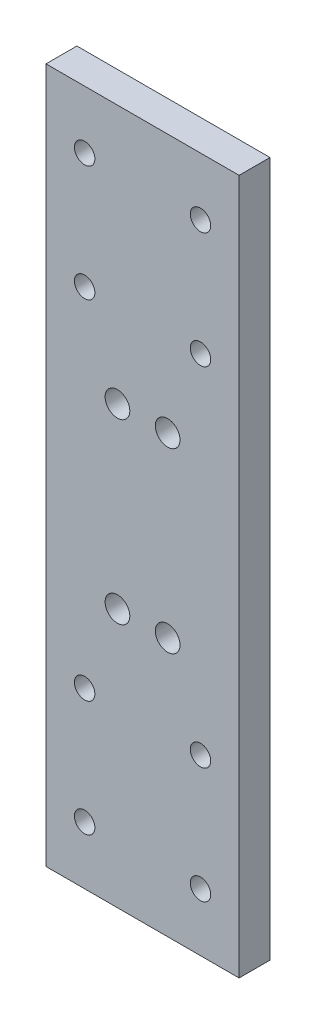
from build123d import *

# Parameters (mm, degrees)
SKETCH1_W            = 50
SKETCH1_H            = 180
BOSS_EXTRUDE1_DEPTH  = 8
M5_CLEARANCE_HOLE1_D = 5.3
M6_CLEARANCE_HOLE1_D = 6.4


with BuildPart() as part:
    # Sketch1 → Boss-Extrude1 (new body)
    with BuildSketch(Plane.XY):
        Rectangle(SKETCH1_W, SKETCH1_H)
    extrude(amount=BOSS_EXTRUDE1_DEPTH)

    # M5 Clearance Hole1 (through all)
    with Locations(Plane.XY.offset(8)):
        with Locations((-15, 45), (-15, -45), (15, -45), (15, 45), (-15, 75), (-15, -75), (15, -75), (15, 75)):
            Hole(M5_CLEARANCE_HOLE1_D / 2)

    # M6 Clearance Hole1 (through all)
    with Locations(Plane.XY.offset(8)):
        with Locations((-6.5, 23), (-6.5, -23), (6.5, -23), (6.5, 23)):
            Hole(M6_CLEARANCE_HOLE1_D / 2)


solid = part.part
